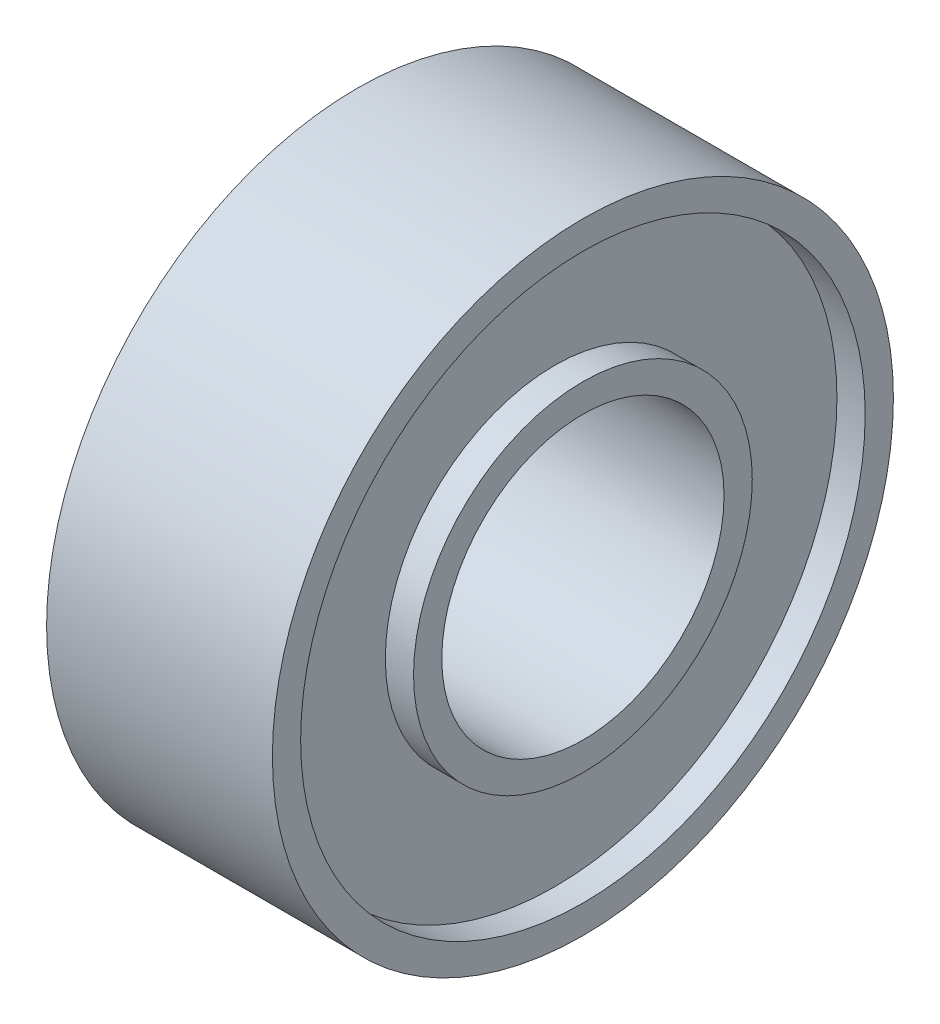
from build123d import *

# Parameters (mm, degrees)
SKETCH1_R           = 5.5
SKETCH1_R_2         = 2.5
BOSS_EXTRUDE1_DEPTH = 4
SKETCH2_R           = 5
SKETCH2_R_2         = 3
CUT_EXTRUDE1_DEPTH  = 0.5
CUT_EXTRUDE2_START  = -0.5
SKETCH3_R           = 5
SKETCH3_R_2         = 3
CUT_EXTRUDE2_DEPTH  = 0.5


with BuildPart() as part:
    # Sketch1 → Boss-Extrude1 (new body)
    with BuildSketch(Plane(origin=(0, 0, 0), x_dir=(0, 0, -1), z_dir=(1, 0, 0))):
        Circle(SKETCH1_R)
        Circle(SKETCH1_R_2, mode=Mode.SUBTRACT)
    extrude(amount=BOSS_EXTRUDE1_DEPTH)

    # Sketch2 → Cut-Extrude1 (cut)
    with BuildSketch(Plane(origin=(4, 0, 0), x_dir=(0, 0, -1), z_dir=(1, 0, 0))):
        Circle(SKETCH2_R)
        Circle(SKETCH2_R_2, mode=Mode.SUBTRACT)
    extrude(amount=-CUT_EXTRUDE1_DEPTH, mode=Mode.SUBTRACT)

    # Sketch3 → Cut-Extrude2 (cut)
    with BuildSketch(Plane.ZY.offset(CUT_EXTRUDE2_START)):
        with Locations(Location((0, 0, 0), (0, 0, 180))):
            Circle(SKETCH3_R)
        with Locations(Location((0, 0, 0), (0, 0, 180))):
            Circle(SKETCH3_R_2, mode=Mode.SUBTRACT)
    extrude(amount=CUT_EXTRUDE2_DEPTH, mode=Mode.SUBTRACT)


solid = part.part
